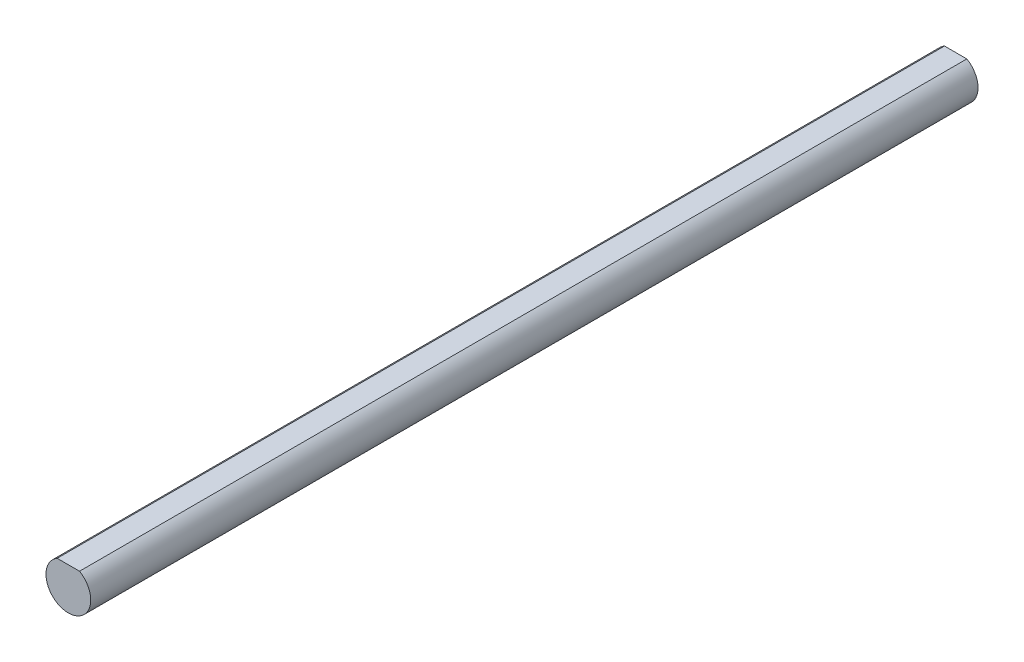
from build123d import *

# Parameters (mm, degrees)
BOSS_EXTRUDE1_DEPTH = 119


with BuildPart() as part:
    # Sketch2 → Boss-Extrude1 (new body)
    with BuildSketch(Plane.XY):
        with BuildLine():
            Line((-1.5, 2.598076211), (1.5, 2.598076211))
            ThreePointArc((1.5, 2.598076211), (0, -3), (-1.5, 2.598076211))
        make_face()
    extrude(amount=BOSS_EXTRUDE1_DEPTH)


solid = part.part
